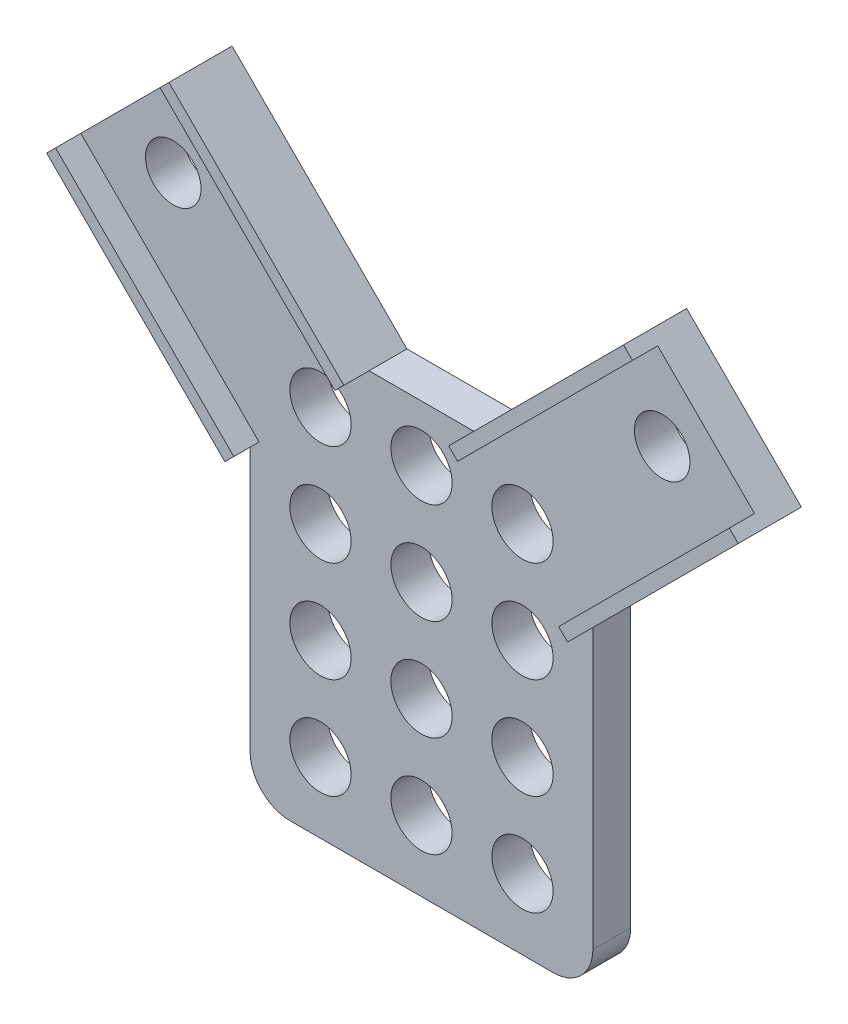
from build123d import *

# Parameters (mm, degrees)
BOSS_EXTRUDE1_DEPTH = 3
SKETCH2_R           = 2.425
CUT_EXTRUDE1_DEPTH  = 3
BOSS_EXTRUDE3_DEPTH = 3
BOSS_EXTRUDE4_DEPTH = 2
SKETCH7_R           = 2.425
SKETCH7_R_2         = 2.2
CUT_EXTRUDE4_DEPTH  = 12


with BuildPart() as part:
    # Sketch1 → Boss-Extrude1 (new body)
    with BuildSketch(Plane.XY):
        with BuildLine():
            Line((3.15, 0), (24, 0))
            ThreePointArc((24, 0), (26.227386361, 0.922613639), (27.15, 3.15))
            Line((27.15, 3.15), (27.15, 34))
            Line((27.15, 34), (0, 34))
            Line((0, 34), (0, 3.15))
            ThreePointArc((0, 3.15), (0.922613639, 0.922613639), (3.15, 0))
        make_face()
    extrude(amount=BOSS_EXTRUDE1_DEPTH)

    # Sketch2 → Cut-Extrude1 (cut)
    with BuildSketch(Plane.XY.offset(3)):
        with Locations((5.575, 5.575)):
            Circle(SKETCH2_R)
        with Locations((13.575, 5.575)):
            Circle(SKETCH2_R)
        with Locations((21.575, 5.575)):
            Circle(SKETCH2_R)
        with Locations((13.575, 13.575)):
            Circle(SKETCH2_R)
        with Locations((21.575, 13.575)):
            Circle(SKETCH2_R)
        with Locations((5.575, 13.575)):
            Circle(SKETCH2_R)
        with Locations((13.575, 21.575)):
            Circle(SKETCH2_R)
        with Locations((21.575, 21.575)):
            Circle(SKETCH2_R)
        with Locations((5.575, 21.575)):
            Circle(SKETCH2_R)
        with Locations((5.575, 29.575)):
            Circle(SKETCH2_R)
        with Locations((13.575, 29.575)):
            Circle(SKETCH2_R)
        with Locations((21.575, 29.575)):
            Circle(SKETCH2_R)
    extrude(amount=-CUT_EXTRUDE1_DEPTH, mode=Mode.SUBTRACT)

    # Sketch3 → Boss-Extrude3 (add)
    with BuildSketch(Plane.XY):
        Polygon((0.024211768, 24.024211768), (9.71157467, 33.71157467), (-4.430560954, 47.853710294), (-14.117923856, 38.166347391), align=None)
        Polygon((17.43842533, 33.71157467), (26.524747468, 24.625252532), (40.666883092, 38.767388155), (31.580560954, 47.853710294), align=None)
    extrude(amount=BOSS_EXTRUDE3_DEPTH)

    # Sketch6 → Boss-Extrude4 (add)
    with BuildSketch(Plane.XY.offset(3)):
        Polygon((-14.117923856, 38.166347391), (0, 24.048423535), (0.707681609, 24.756105144), (-13.410242247, 38.874029), align=None)
        Polygon((-4.430560954, 47.853710294), (9.42314934, 34), (8.716042559, 33.292893219), (-5.137667735, 47.146603512), align=None)
        Polygon((17.72685066, 34), (31.580560954, 47.853710294), (32.287667735, 47.146603512), (18.433957441, 33.292893219), align=None)
        Polygon((27.15, 25.250505063), (40.666883092, 38.767388155), (39.959776311, 39.474494937), (26.442893219, 25.957611845), align=None)
    extrude(amount=BOSS_EXTRUDE4_DEPTH)

    # Sketch7 → Cut-Extrude4 (cut)
    with BuildSketch(Plane.XY.offset(3)):
        with Locations((5.575, 29.575)):
            Circle(SKETCH7_R)
        with Locations((21.575, 29.575)):
            Circle(SKETCH7_R)
        with Locations((-6.091687062, 39.828623155)):
            Circle(SKETCH7_R_2)
        with Locations((32.641221126, 40.429089091)):
            Circle(SKETCH7_R_2)
    extrude(amount=-CUT_EXTRUDE4_DEPTH, mode=Mode.SUBTRACT)


solid = part.part
